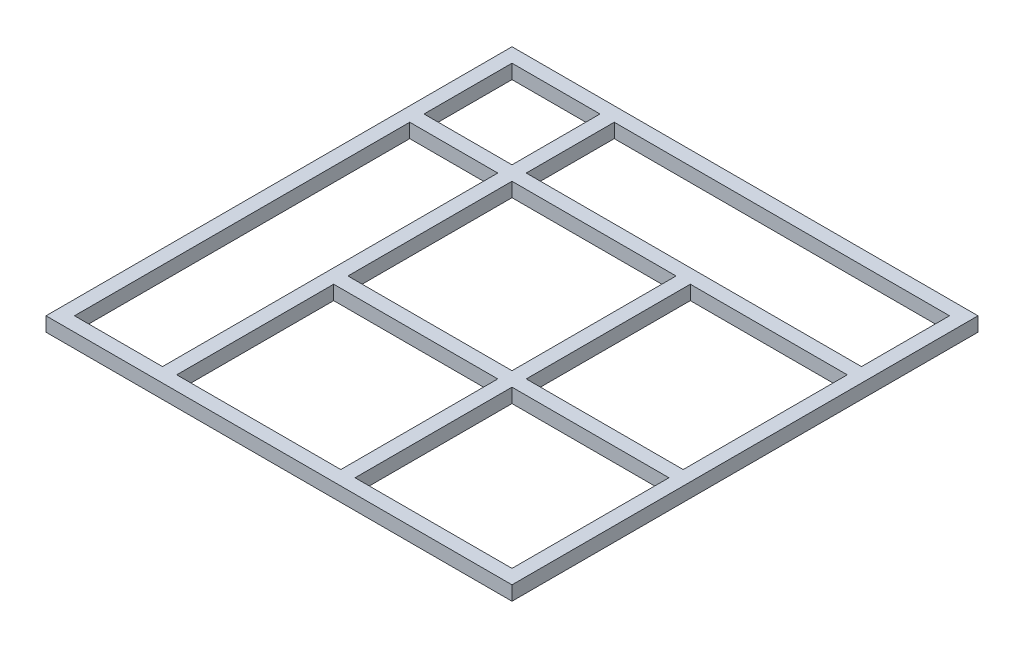
from build123d import *

# Parameters (mm, degrees)
SKETCH2_W           = 426.044
SKETCH2_H           = 426.044
SKETCH2_W_2         = 80.467
SKETCH2_H_2         = 306.511
SKETCH2_H_3         = 80.467
SKETCH2_W_3         = 143.489
SKETCH2_H_4         = 143.489
SKETCH2_W_4         = 306.511
SKETCH2_W_5         = 150
SKETCH2_H_5         = 150
BOSS_EXTRUDE1_DEPTH = 13.022


with BuildPart() as part:
    # Sketch2 → Boss-Extrude1 (new body)
    with BuildSketch(Plane(origin=(0, 0, 0), x_dir=(1, 0, 0), z_dir=(0, 1, 0))):
        with Locations((213.022, 213.022)):
            Rectangle(SKETCH2_W, SKETCH2_H)
        with Locations((53.2555, 166.2775)):
            Rectangle(SKETCH2_W_2, SKETCH2_H_2, mode=Mode.SUBTRACT)
        with Locations((53.2555, 372.7885)):
            Rectangle(SKETCH2_W_2, SKETCH2_H_3, mode=Mode.SUBTRACT)
        with Locations((341.2775, 84.7665)):
            Rectangle(SKETCH2_W_3, SKETCH2_H_4, mode=Mode.SUBTRACT)
        with Locations((259.7665, 372.7885)):
            Rectangle(SKETCH2_W_4, SKETCH2_H_3, mode=Mode.SUBTRACT)
        with Locations((181.511, 84.7665)):
            Rectangle(SKETCH2_W_5, SKETCH2_H_4, mode=Mode.SUBTRACT)
        with Locations((181.511, 244.533)):
            Rectangle(SKETCH2_W_5, SKETCH2_H_5, mode=Mode.SUBTRACT)
        with Locations((341.2775, 244.533)):
            Rectangle(SKETCH2_W_3, SKETCH2_H_5, mode=Mode.SUBTRACT)
    extrude(amount=BOSS_EXTRUDE1_DEPTH)


solid = part.part
